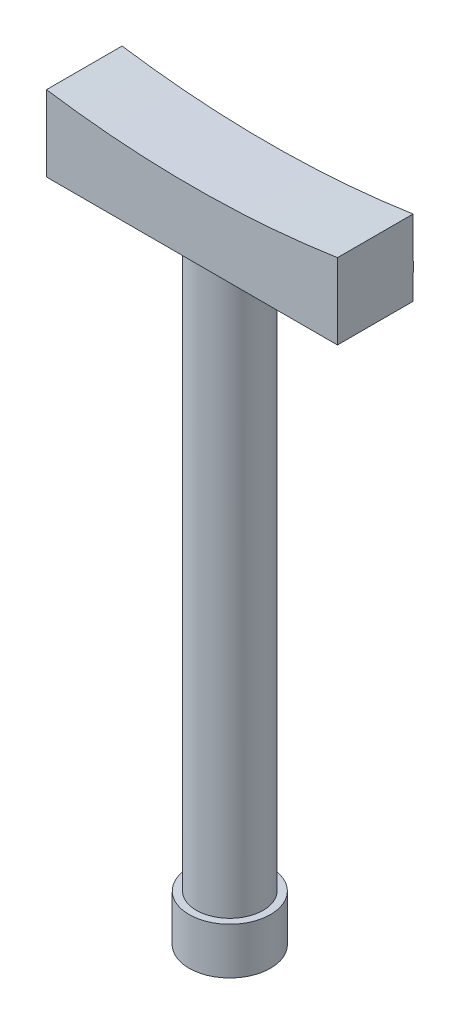
from build123d import *

# Parameters (mm, degrees)
SKETCH1_R            = 7
SKETCH1_R_2          = 4
BOSS_EXTRUDE1_DEPTH  = 8
SKETCH1_3_R          = 4.75
SKETCH1_3_R_2        = 4
BOSS_EXTRUDE2_DEPTH  = 80
SKETCH3_R            = 5.75
SKETCH3_R_2          = 3.05
BOSS_EXTRUDE3_DEPTH  = 105
SKETCH8_W            = 50
SKETCH8_H            = 13
BOSS_EXTRUDE8_DEPTH  = 4
SKETCH9_W            = 50
SKETCH9_H            = 6.245985434
BOSS_EXTRUDE9_DEPTH  = 9
BOSS_EXTRUDE10_DEPTH = 50
SKETCH11_W           = 50
SKETCH11_H           = 12.98265639
BOSS_EXTRUDE11_DEPTH = 10
CUT_EXTRUDE1_DEPTH   = 100


with BuildPart() as part:
    # Sketch1 → Boss-Extrude1 (new body)
    with BuildSketch(Plane(origin=(0, 0, 0), x_dir=(1, 0, 0), z_dir=(0, 1, 0))):
        Circle(SKETCH1_R)
        Circle(SKETCH1_R_2, mode=Mode.SUBTRACT)
    extrude(amount=BOSS_EXTRUDE1_DEPTH)

    # Sketch1<3> → Boss-Extrude2 (add)
    with BuildSketch(Plane(origin=(0, 0, 0), x_dir=(1, 0, 0), z_dir=(0, 1, 0))):
        Circle(SKETCH1_3_R)
        Circle(SKETCH1_3_R_2, mode=Mode.SUBTRACT)
    extrude(amount=BOSS_EXTRUDE2_DEPTH)

    # Sketch3 → Boss-Extrude3 (add)
    with BuildSketch(Plane.XZ):
        Circle(SKETCH3_R)
        Circle(SKETCH3_R_2, mode=Mode.SUBTRACT)
    extrude(amount=-BOSS_EXTRUDE3_DEPTH)

    # Sketch8 → Boss-Extrude8 (add)
    with BuildSketch(Plane(origin=(0, 105, 0), x_dir=(1, 0, 0), z_dir=(0, 1, 0))):
        Rectangle(SKETCH8_W, SKETCH8_H)
    extrude(amount=BOSS_EXTRUDE8_DEPTH)

    # Sketch9 → Boss-Extrude9 (add)
    with BuildSketch(Plane(origin=(0, 109, 0), x_dir=(1, 0, 0), z_dir=(0, 1, 0))):
        with Locations((0, -3.377007283)):
            Rectangle(SKETCH9_W, SKETCH9_H)
    extrude(amount=BOSS_EXTRUDE9_DEPTH)

    # Sketch10 → Boss-Extrude10 (add)
    with BuildSketch(Plane.ZY.offset(25)):
        with BuildLine():
            Line((0.254014566, 118), (0.254014566, 109))
            Line((0.254014566, 109), (-6.5, 109))
            ThreePointArc((-6.5, 109), (-4.986953748, 114.898802217), (0.254014566, 118))
        make_face()
    extrude(amount=-BOSS_EXTRUDE10_DEPTH)

    # Sketch11 → Boss-Extrude11 (add)
    with BuildSketch(Plane(origin=(0, 118, 0), x_dir=(1, 0, 0), z_dir=(0, 1, 0))):
        Rectangle(SKETCH11_W, SKETCH11_H)
    extrude(amount=-BOSS_EXTRUDE11_DEPTH)

    # Sketch12 → Cut-Extrude1 (cut)
    with BuildSketch(Plane(origin=(0, 0, -6.491328195), x_dir=(-1, 0, 0), z_dir=(0, 0, -1))):
        with BuildLine():
            Line((-25, 118), (25, 118))
            ThreePointArc((25, 118), (0, 116.124221553), (-25, 118))
        make_face()
    extrude(amount=-CUT_EXTRUDE1_DEPTH, mode=Mode.SUBTRACT)


solid = part.part
